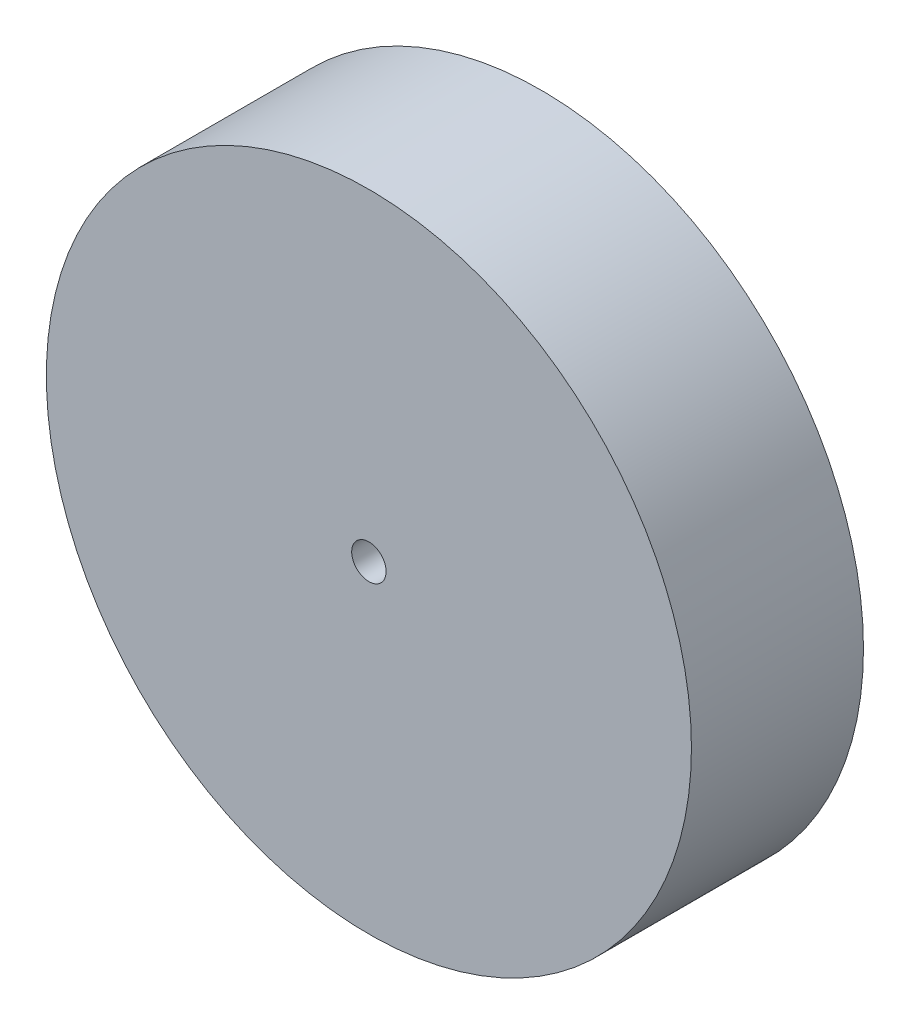
from build123d import *

# Parameters (mm, degrees)
SKETCH_1_R      = 37.5
SKETCH_1_R_2    = 2
EXTRUDE_1_DEPTH = 20


with BuildPart() as part:
    # 草圖1 → 填料-伸長1 (new body)
    with BuildSketch(Plane.XY):
        Circle(SKETCH_1_R)
        Circle(SKETCH_1_R_2, mode=Mode.SUBTRACT)
    extrude(amount=EXTRUDE_1_DEPTH)


solid = part.part
